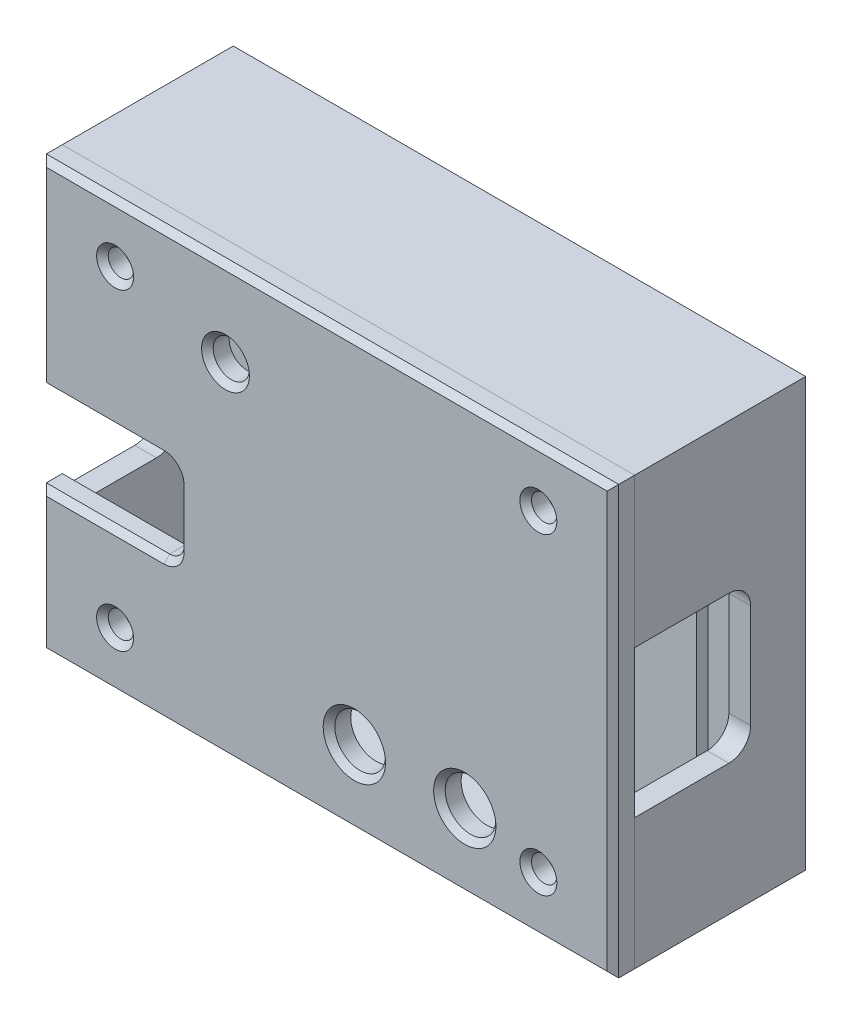
from build123d import *

# Parameters (mm, degrees)
SKETCH1_W           = 70
SKETCH1_H           = 50
SKETCH1_R           = 1.4
BOSS_EXTRUDE1_DEPTH = 1.6
SKETCH2_W           = 73
SKETCH2_H           = 53
SKETCH2_R           = 1.4
BOSS_EXTRUDE2_DEPTH = 3
SKETCH3_W           = 79
SKETCH3_H           = 59
SKETCH3_W_2         = 73
SKETCH3_H_2         = 53
BOSS_EXTRUDE3_DEPTH = 23.6
SKETCH4_W           = 79
SKETCH4_H           = 59
SKETCH4_R           = 1.75
BOSS_EXTRUDE4_DEPTH = 3
SKETCH9_W           = 3
SKETCH9_H           = 27.56
CUT_EXTRUDE5_DEPTH  = 13
SKETCH7_R           = 3.5
SKETCH7_R_2         = 2.5
CUT_EXTRUDE3_DEPTH  = 52.83145763
SKETCH8_W           = 4.5
SKETCH8_H           = 20.32
CUT_EXTRUDE4_DEPTH  = 16
FILLET3_R           = 3
FILLET4_R           = 3
SKETCH10_W          = 19.02
SKETCH10_H          = 12
CUT_EXTRUDE6_DEPTH  = 57.018389838
FILLET5_R           = 2
CHAMFER1_SIZE       = 0.8


with BuildPart() as part:
    # Sketch1 → Boss-Extrude1 (new body)
    with BuildSketch(Plane.XY):
        Rectangle(SKETCH1_W, SKETCH1_H)
        with Locations((-29.21, 21.59)):
            Circle(SKETCH1_R, mode=Mode.SUBTRACT)
        with Locations((29.21, 21.59)):
            Circle(SKETCH1_R, mode=Mode.SUBTRACT)
        with Locations((-29.21, -21.59)):
            Circle(SKETCH1_R, mode=Mode.SUBTRACT)
        with Locations((29.21, -21.59)):
            Circle(SKETCH1_R, mode=Mode.SUBTRACT)
    extrude(amount=BOSS_EXTRUDE1_DEPTH)


with BuildPart() as body_2:
    # Sketch2 → Boss-Extrude2 (new body)
    with BuildSketch(Plane.XY.offset(-6)):
        Rectangle(SKETCH2_W, SKETCH2_H)
        with Locations((29.21, 21.59)):
            Circle(SKETCH2_R, mode=Mode.SUBTRACT)
        with Locations((29.21, -21.59)):
            Circle(SKETCH2_R, mode=Mode.SUBTRACT)
        with Locations((-29.21, -21.59)):
            Circle(SKETCH2_R, mode=Mode.SUBTRACT)
        with Locations((-29.21, 21.59)):
            Circle(SKETCH2_R, mode=Mode.SUBTRACT)
    extrude(amount=-BOSS_EXTRUDE2_DEPTH)

    # Sketch3 → Boss-Extrude3 (add)
    with BuildSketch(Plane(origin=(0, 0, -9), x_dir=(-1, 0, 0), z_dir=(0, 0, -1))):
        Rectangle(SKETCH3_W, SKETCH3_H)
        Rectangle(SKETCH3_W_2, SKETCH3_H_2, mode=Mode.SUBTRACT)
    extrude(amount=-BOSS_EXTRUDE3_DEPTH)

    # Sketch9 → Cut-Extrude5 (cut)
    with BuildSketch(Plane.XY.offset(14.6)):
        with Locations((-38, 2.35)):
            Rectangle(SKETCH9_W, SKETCH9_H)
    extrude(amount=-CUT_EXTRUDE5_DEPTH, mode=Mode.SUBTRACT)

    # Sketch8 → Cut-Extrude4 (cut)
    with BuildSketch(Plane.XY.offset(14.6)):
        with Locations((37.25, -1.27)):
            Rectangle(SKETCH8_W, SKETCH8_H)
    extrude(amount=-CUT_EXTRUDE4_DEPTH, mode=Mode.SUBTRACT)

    # Fillet3
    fillet3_edges = [body_2.edges().sort_by_distance(p)[0] for p in [
        (38, -11.43, -1.4),
        (38, 8.89, -1.4),
        (-38, -11.43, 1.6),
        (-38, 16.13, 1.6),
    ]]
    fillet(fillet3_edges, radius=FILLET3_R)

    # Fillet4
    fillet4_edges = [body_2.edges().sort_by_distance(p)[0] for p in [
        (-36.5, -26.5, 4.3),
        (-36.5, 26.5, 4.3),
        (36.5, 26.5, 4.3),
        (36.5, -26.5, 4.3),
        (-36.5, 0, -6),
        (0, 26.5, -6),
        (36.5, 0, -6),
        (0, -26.5, -6),
    ]]
    fillet(fillet4_edges, radius=FILLET4_R)


with BuildPart() as body_3:
    # Sketch4 → Boss-Extrude4 (new body)
    with BuildSketch(Plane.XY.offset(14.6)):
        Rectangle(SKETCH4_W, SKETCH4_H)
        with Locations((-29.21, 21.59)):
            Circle(SKETCH4_R, mode=Mode.SUBTRACT)
        with Locations((29.21, 21.59)):
            Circle(SKETCH4_R, mode=Mode.SUBTRACT)
        with Locations((29.21, -21.59)):
            Circle(SKETCH4_R, mode=Mode.SUBTRACT)
        with Locations((-29.21, -21.59)):
            Circle(SKETCH4_R, mode=Mode.SUBTRACT)
    extrude(amount=BOSS_EXTRUDE4_DEPTH)

    # Sketch7 → Cut-Extrude3 (cut, through all)
    with BuildSketch(Plane.XY.offset(1.6)):
        with Locations(Location((3.81, -19.05, 0), (0, 0, 180))):
            Circle(SKETCH7_R)
        with Locations(Location((19.05, -19.05, 0), (0, 0, 180))):
            Circle(SKETCH7_R)
        with Locations(Location((-13.97, 17.78, 0), (0, 0, 180))):
            Circle(SKETCH7_R_2)
    extrude(amount=CUT_EXTRUDE3_DEPTH, mode=Mode.SUBTRACT)

    # Sketch10 → Cut-Extrude6 (cut, through all)
    with BuildSketch(Plane.XY.offset(17.6)):
        with Locations((-29.99, -3.81)):
            Rectangle(SKETCH10_W, SKETCH10_H)
    extrude(amount=-CUT_EXTRUDE6_DEPTH, mode=Mode.SUBTRACT)

    # Fillet5
    fillet5_edges = [body_3.edges().sort_by_distance(p)[0] for p in [
        (-20.48, 2.19, 16.1),
        (-20.48, -9.81, 16.1),
    ]]
    fillet(fillet5_edges, radius=FILLET5_R)

    # Chamfer1
    chamfer1_edges = [body_3.edges().sort_by_distance(p)[0] for p in [
        (0, 29.5, 17.6),
        (-30.96, 21.59, 17.6),
        (-39.5, 15.845, 17.6),
        (27.46, 21.59, 17.6),
        (27.46, -21.59, 17.6),
        (-30.96, -21.59, 17.6),
        (-11.47, 17.78, 17.6),
        (22.55, -19.05, 17.6),
        (0, -29.5, 17.6),
        (7.31, -19.05, 17.6),
        (-39.5, -19.655, 17.6),
        (-30.99, -9.81, 17.6),
        (-20.48, -3.81, 17.6),
        (39.5, 0, 17.6),
        (-30.99, 2.19, 17.6),
        (-21.065786438, -9.224213562, 17.6),
        (-21.065786438, 1.604213562, 17.6),
    ]]
    chamfer(chamfer1_edges, length=CHAMFER1_SIZE)


solid = Compound([part.part, body_2.part, body_3.part])
